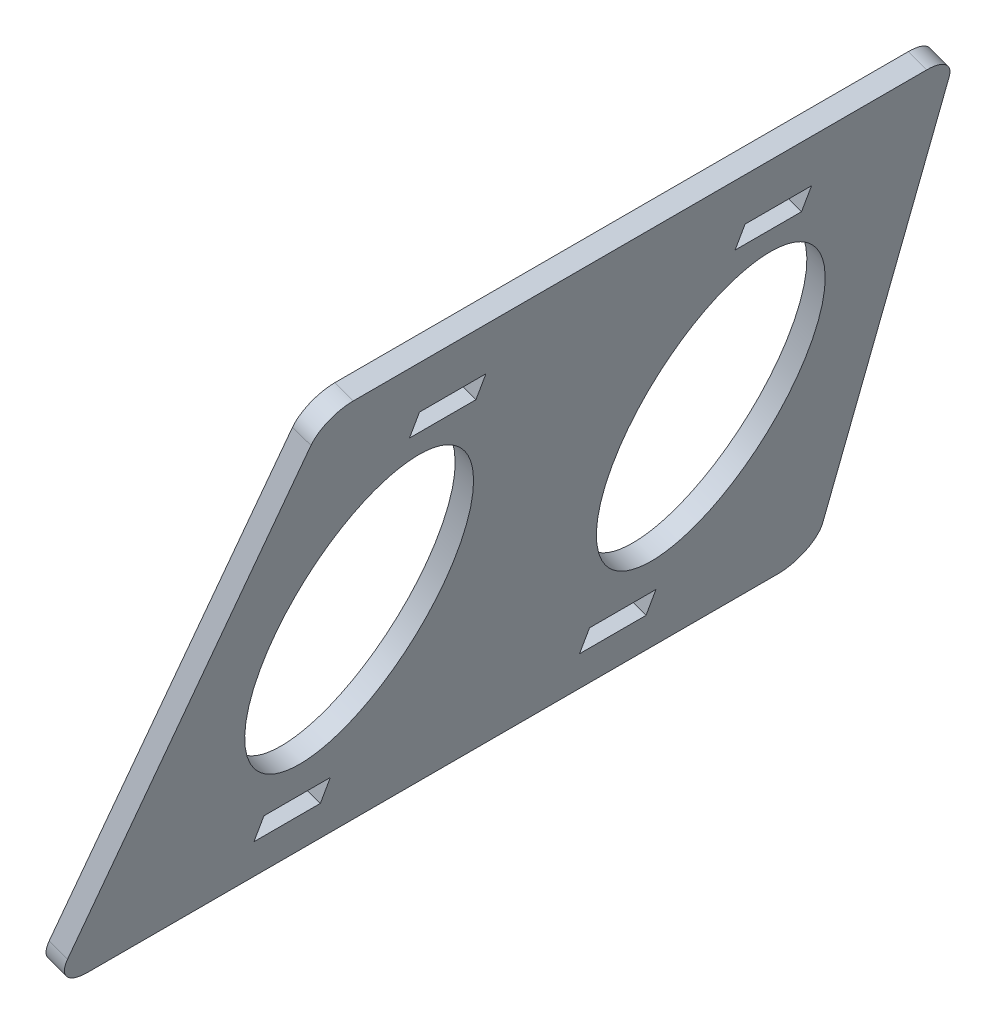
from build123d import *

# Parameters (mm, degrees)
BOSS_EXTRUDE1_DEPTH        = 58
SKETCH2_OUTSIDE_W          = 147.986
SKETCH2_OUTSIDE_H          = 126.948
TAB_AND_SLOT_CONTOUR_DEPTH = 3
MOUNTING_TAB_SLOT_REACH    = 197.382
SKETCH4_W                  = 10.2
SKETCH4_H                  = 4.48444402
EYE_APERTURE_REACH         = 197.382
SKETCH3_RX                 = 26.778256145
SKETCH3_RY                 = 15


with BuildPart() as part:
    # Sketch1 → Boss-Extrude1 (new, symmetric)
    with BuildSketch(Plane.XY):
        Polygon((-66.659178779, 221.764297559), (-69.478256642, 222.790357989), (-101.297584098, 135.367474301), (-98.478506236, 134.341413871), align=None)
    extrude(amount=BOSS_EXTRUDE1_DEPTH, both=True)

    # Sketch2 outside → tab and slot contour (cut)
    with BuildSketch(Plane(origin=(-132.954285367, 48.391402392, 0), x_dir=(0, 0, 1), z_dir=(-0.9396926207859096, 0.34202014332566527, 0))):
        with Locations((0, 139.075)):
            Rectangle(SKETCH2_OUTSIDE_W, SKETCH2_OUTSIDE_H)
        with BuildLine():
            Line((57.97107056, 98.09508485), (49, 181.128574477))
            ThreePointArc((49, 181.128574477), (47.369183029, 184.312070804), (44.02892944, 185.59149209))
            Line((44.02892944, 185.59149209), (-44.02892944, 185.59149209))
            ThreePointArc((-44.02892944, 185.59149209), (-47.369183029, 184.312070804), (-49, 181.128574477))
            Line((-49, 181.128574477), (-57.97107056, 98.09508485))
            ThreePointArc((-57.97107056, 98.09508485), (-56.720578714, 94.217748875), (-53, 92.558002463))
            Line((-53, 92.558002463), (53, 92.558002463))
            ThreePointArc((53, 92.558002463), (56.720578714, 94.217748875), (57.97107056, 98.09508485))
        make_face(mode=Mode.SUBTRACT)
    extrude(amount=-TAB_AND_SLOT_CONTOUR_DEPTH, mode=Mode.SUBTRACT)

    # Sketch4 → mounting tab slot (cut, up to next)
    with BuildSketch(Plane(origin=(-132.954285367, 48.391402392, 0), x_dir=(0, 0, 1), z_dir=(-0.9396926207859096, 0.3420201433256655, 0)), mode=Mode.PRIVATE) as mounting_tab_slot_sk1:
        with Locations((-25, 172.357359377)):
            Rectangle(SKETCH4_W, SKETCH4_H)
    mounting_tab_slot_tool1 = extrude(mounting_tab_slot_sk1.sketch, amount=-MOUNTING_TAB_SLOT_REACH, mode=Mode.PRIVATE) & part.part
    # Sketch4 → mounting tab slot (cut, up to next)
    with BuildSketch(Plane(origin=(-132.954285367, 48.391402392, 0), x_dir=(0, 0, 1), z_dir=(-0.9396926207859096, 0.3420201433256655, 0)), mode=Mode.PRIVATE) as mounting_tab_slot_sk2:
        with Locations((-25, 102.516403068)):
            Rectangle(SKETCH4_W, SKETCH4_H)
    mounting_tab_slot_tool2 = extrude(mounting_tab_slot_sk2.sketch, amount=-MOUNTING_TAB_SLOT_REACH, mode=Mode.PRIVATE) & part.part
    # Sketch4 → mounting tab slot (cut, up to next)
    with BuildSketch(Plane(origin=(-132.954285367, 48.391402392, 0), x_dir=(0, 0, 1), z_dir=(-0.9396926207859096, 0.3420201433256655, 0)), mode=Mode.PRIVATE) as mounting_tab_slot_sk3:
        with Locations((25, 172.357359377)):
            Rectangle(SKETCH4_W, SKETCH4_H)
    mounting_tab_slot_tool3 = extrude(mounting_tab_slot_sk3.sketch, amount=-MOUNTING_TAB_SLOT_REACH, mode=Mode.PRIVATE) & part.part
    # Sketch4 → mounting tab slot (cut, up to next)
    with BuildSketch(Plane(origin=(-132.954285367, 48.391402392, 0), x_dir=(0, 0, 1), z_dir=(-0.9396926207859096, 0.3420201433256655, 0)), mode=Mode.PRIVATE) as mounting_tab_slot_sk4:
        with Locations((25, 102.516403068)):
            Rectangle(SKETCH4_W, SKETCH4_H)
    mounting_tab_slot_tool4 = extrude(mounting_tab_slot_sk4.sketch, amount=-MOUNTING_TAB_SLOT_REACH, mode=Mode.PRIVATE) & part.part
    add(mounting_tab_slot_tool1.solids().sort_by_distance((-74.004597, 210.354341, -25))[0], mode=Mode.SUBTRACT)
    add(mounting_tab_slot_tool2.solids().sort_by_distance((-97.89161, 144.72531, -25))[0], mode=Mode.SUBTRACT)
    add(mounting_tab_slot_tool3.solids().sort_by_distance((-74.004597, 210.354341, 25))[0], mode=Mode.SUBTRACT)
    add(mounting_tab_slot_tool4.solids().sort_by_distance((-97.89161, 144.72531, 25))[0], mode=Mode.SUBTRACT)

    # Sketch3 → eye aperture (cut, up to next)
    with BuildSketch(Plane(origin=(-132.954285367, 48.391402392, 0), x_dir=(0, 0, 1), z_dir=(-0.9396926207859096, 0.3420201433256652, 0)), mode=Mode.PRIVATE) as eye_aperture_sk1:
        with Locations(Location((-27, 138.436881223), (0, 0, -90))):
            Ellipse(SKETCH3_RX, SKETCH3_RY)
    eye_aperture_tool1 = extrude(eye_aperture_sk1.sketch, amount=-EYE_APERTURE_REACH, mode=Mode.PRIVATE) & part.part
    # Sketch3 → eye aperture (cut, up to next)
    with BuildSketch(Plane(origin=(-132.954285367, 48.391402392, 0), x_dir=(0, 0, 1), z_dir=(-0.9396926207859096, 0.3420201433256652, 0)), mode=Mode.PRIVATE) as eye_aperture_sk2:
        with Locations(Location((27, 138.436881223), (0, 0, -90))):
            Ellipse(SKETCH3_RX, SKETCH3_RY)
    eye_aperture_tool2 = extrude(eye_aperture_sk2.sketch, amount=-EYE_APERTURE_REACH, mode=Mode.PRIVATE) & part.part
    add(eye_aperture_tool1.solids().sort_by_distance((-85.606083, 178.479518, -27))[0], mode=Mode.SUBTRACT)
    add(eye_aperture_tool2.solids().sort_by_distance((-85.606083, 178.479518, 27))[0], mode=Mode.SUBTRACT)


solid = part.part
